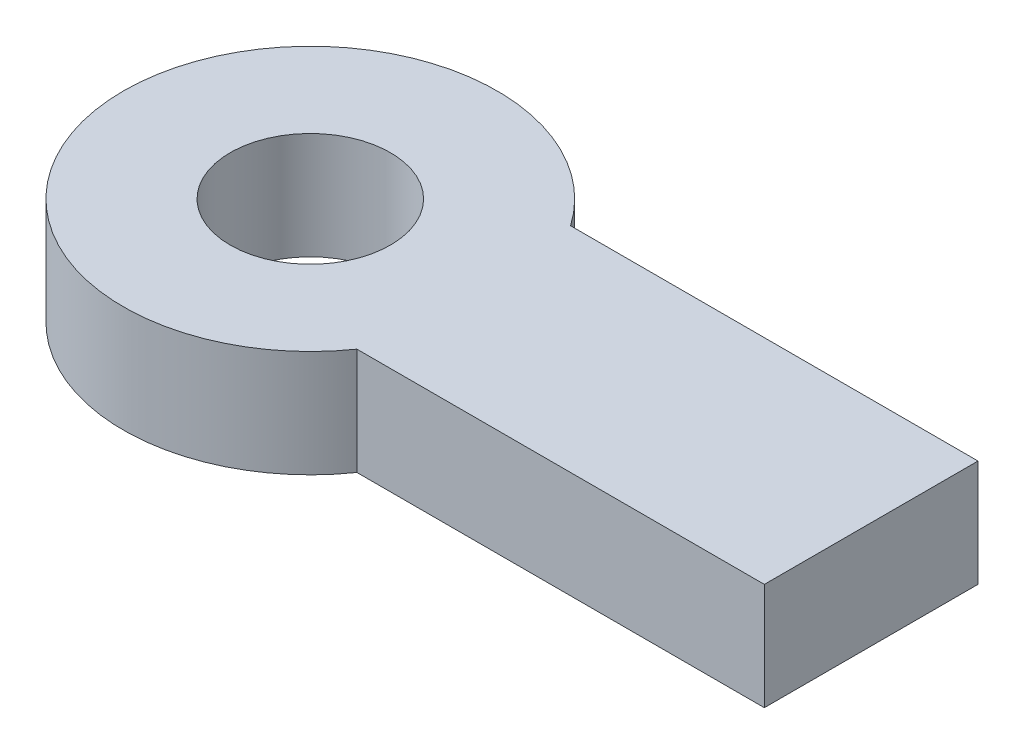
from build123d import *

# Parameters (mm, degrees)
SZKIC1_R                    = 1.5
DODANIE_WYCI_GNI_CIE1_DEPTH = 2


with BuildPart() as part:
    # Szkic1 → Dodanie-wyciągnięcie1 (new body)
    with BuildSketch(Plane(origin=(0, 0, 0), x_dir=(1, 0, 0), z_dir=(0, 1, 0))):
        with BuildLine():
            Line((3.5, 2), (10.5, 2))
            Line((10.5, 2), (10.5, -2))
            Line((10.5, -2), (3.5, -2))
            Line((3.5, -2), (2.872281323, -2))
            ThreePointArc((2.872281323, -2), (-3.5, 0), (2.872281323, 2))
            Line((2.872281323, 2), (3.5, 2))
        make_face()
        with Locations(Location((0, 0, 0), (0, 0, 270))):
            Circle(SZKIC1_R, mode=Mode.SUBTRACT)
    extrude(amount=DODANIE_WYCI_GNI_CIE1_DEPTH)


solid = part.part
